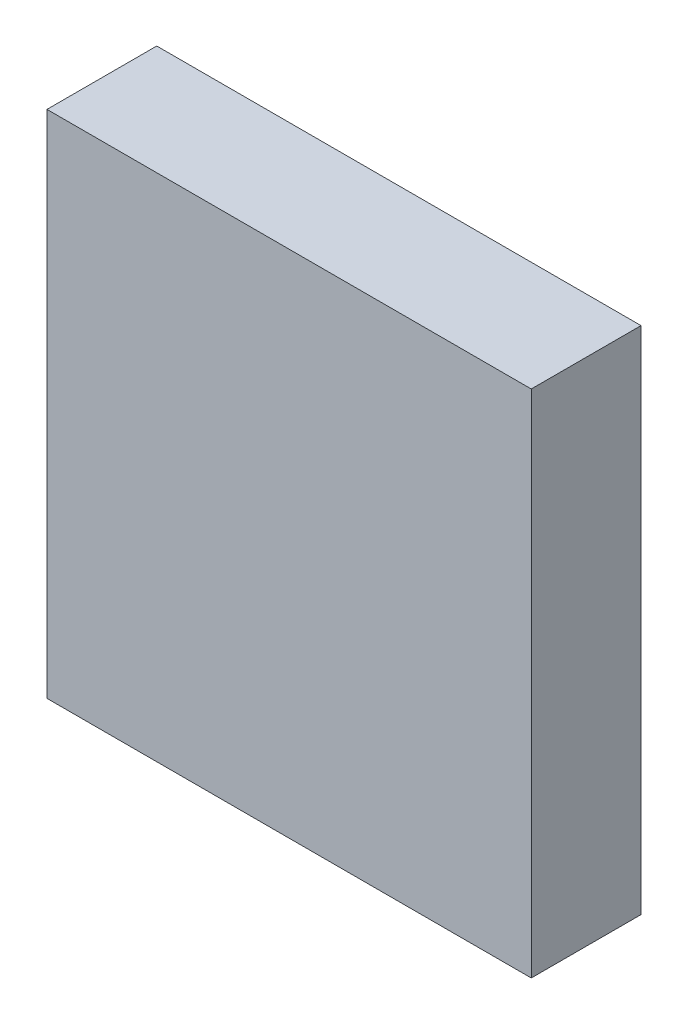
from build123d import *

# Parameters (mm, degrees)
SKETCH1_W           = 75
SKETCH1_H           = 79
BOSS_EXTRUDE1_DEPTH = 17


with BuildPart() as part:
    # Sketch1 → Boss-Extrude1 (new body)
    with BuildSketch(Plane.XY):
        Rectangle(SKETCH1_W, SKETCH1_H)
    extrude(amount=BOSS_EXTRUDE1_DEPTH)


solid = part.part
